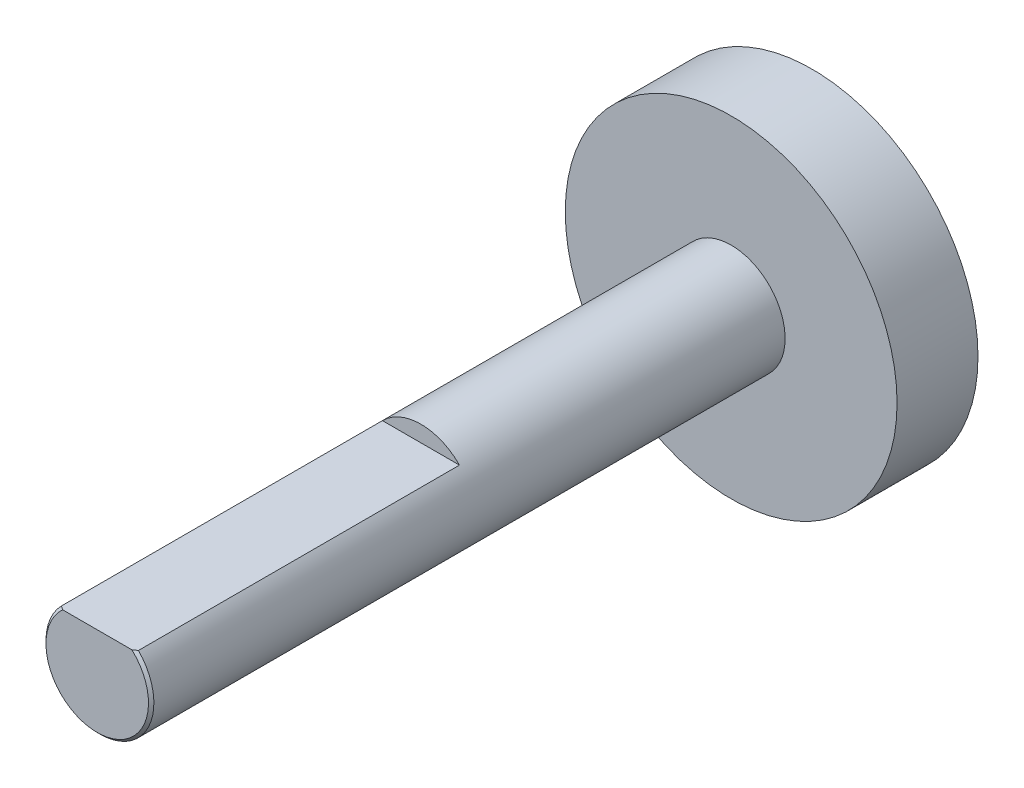
from build123d import *

# Parameters (mm, degrees)
SKETCH1_R           = 2
BOSS_EXTRUDE1_DEPTH = 26.5
SKETCH2_R           = 6.15
BOSS_EXTRUDE2_DEPTH = 3
CHAMFER1_SIZE       = 0.1
CUT_EXTRUDE2_DEPTH  = 12


with BuildPart() as part:
    # Sketch1 → Boss-Extrude1 (new body)
    with BuildSketch(Plane.XY):
        Circle(SKETCH1_R)
    extrude(amount=-BOSS_EXTRUDE1_DEPTH)

    # Sketch2 → Boss-Extrude2 (add)
    with BuildSketch(Plane(origin=(0, 0, -26.5), x_dir=(-1, 0, 0), z_dir=(0, 0, -1))):
        Circle(SKETCH2_R)
    extrude(amount=-BOSS_EXTRUDE2_DEPTH)

    # Chamfer1
    chamfer1_edges = [part.edges().sort_by_distance(p)[0] for p in [
        (-2, 0, 0),
    ]]
    chamfer(chamfer1_edges, length=CHAMFER1_SIZE)

    # Sketch3 → Cut-Extrude2 (cut)
    with BuildSketch(Plane.XY):
        with BuildLine():
            Line((1.428285686, 1.4), (-1.428285686, 1.4))
            ThreePointArc((-1.428285686, 1.4), (0, 2), (1.428285686, 1.4))
        make_face()
    extrude(amount=-CUT_EXTRUDE2_DEPTH, mode=Mode.SUBTRACT)


solid = part.part
